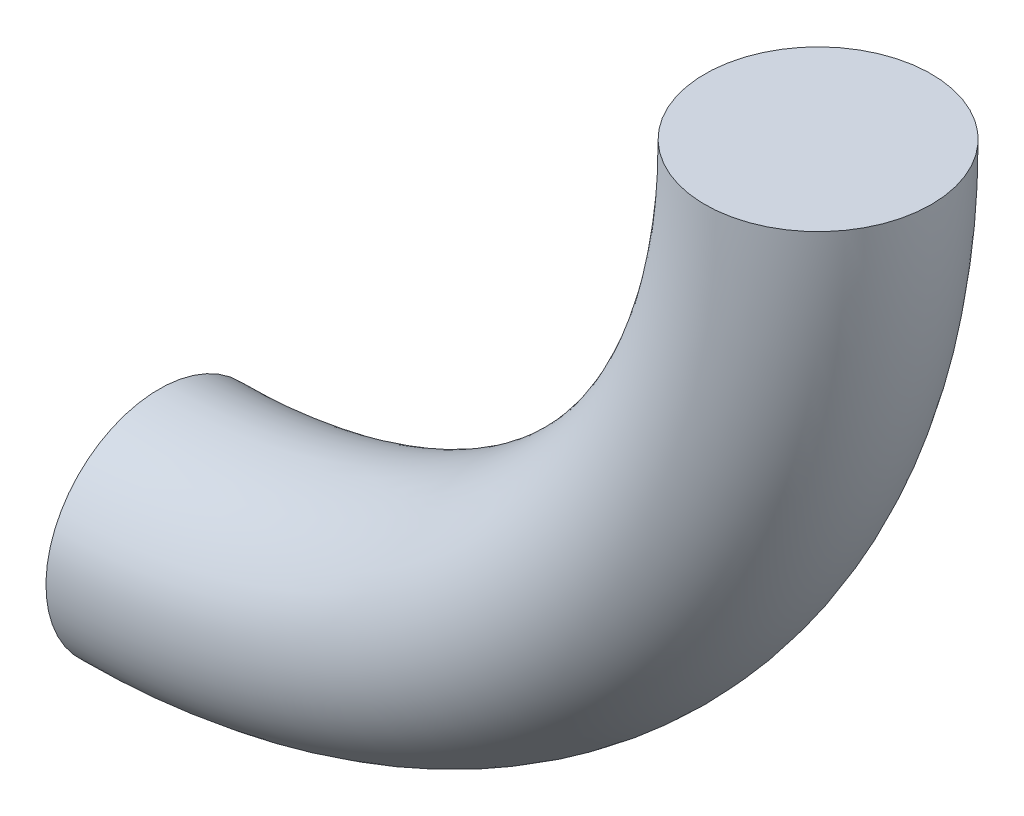
from build123d import *

# Parameters (mm, degrees)
SWEEPSECTION_R = 7.093


with BuildPart() as part:
    # OrdinarySweptBoss: sweep along a path in SweepPath
    with BuildLine(Plane.XY) as ordinarysweptboss_path:
        ThreePointArc((0, 0), (29.201388743, 12.095611257), (41.297, 41.297))
    # SweepSection → OrdinarySweptBoss (sweep)
    with BuildSketch(Plane(origin=(0, 0, 0), x_dir=(0, 0, -1), z_dir=(1, 0, 0))):
        Circle(SWEEPSECTION_R)
    sweep(path=ordinarysweptboss_path.line)


solid = part.part
